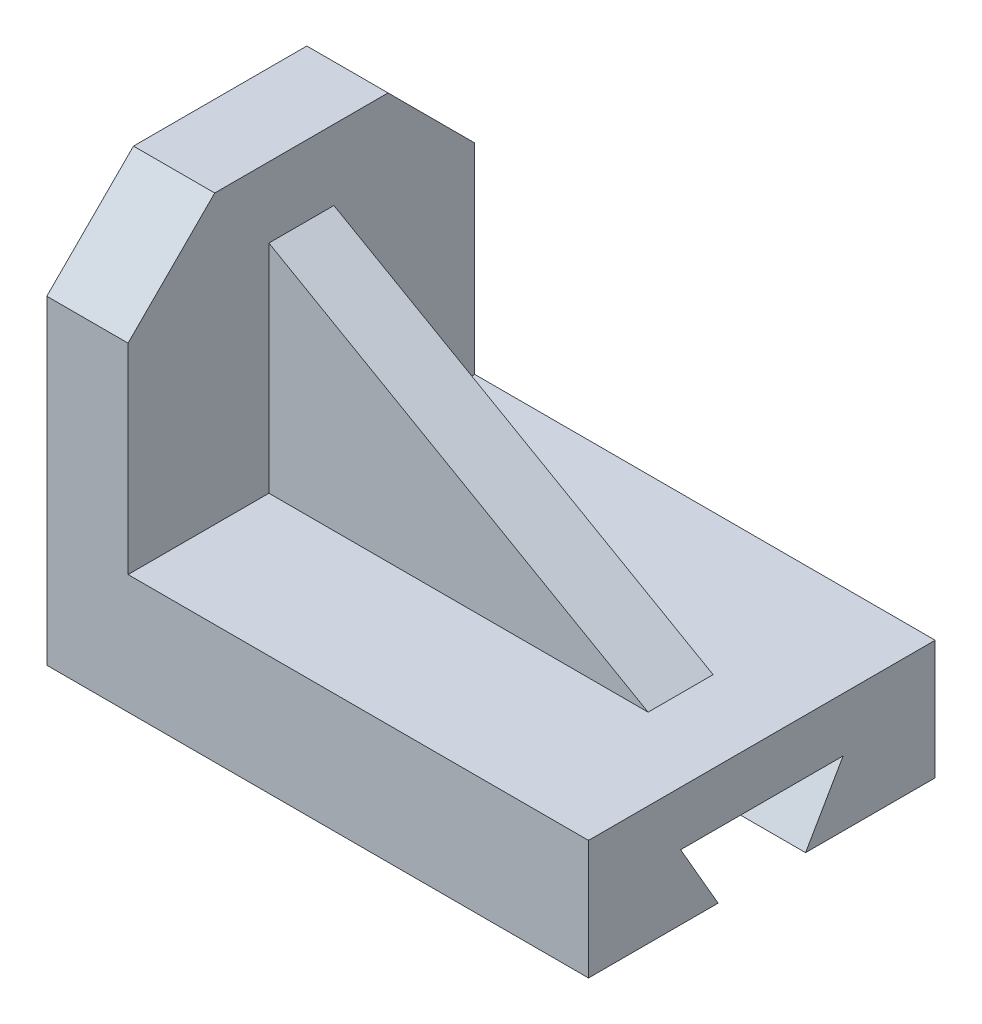
from build123d import *

# Parameters (mm, degrees)
SKETCH1_W           = 100
SKETCH1_H           = 22
BOSS_EXTRUDE1_DEPTH = 64
BOSS_EXTRUDE2_DEPTH = 15
SKETCH3_W           = 12
SKETCH3_H           = 40
BOSS_EXTRUDE3_DEPTH = 70
CUT_EXTRUDE1_DEPTH  = 70
CUT_EXTRUDE2_DEPTH  = 141.431477953


with BuildPart() as part:
    # Sketch1 → Boss-Extrude1 (new body)
    with BuildSketch(Plane.XY):
        with Locations((50, 11)):
            Rectangle(SKETCH1_W, SKETCH1_H)
    extrude(amount=BOSS_EXTRUDE1_DEPTH)

    # Sketch2 → Boss-Extrude2 (add)
    with BuildSketch(Plane.ZY):
        Polygon((64, 0), (0, 0), (0, 59), (16, 75), (48, 75), (64, 59), align=None)
    extrude(amount=-BOSS_EXTRUDE2_DEPTH)

    # Sketch3 → Boss-Extrude3 (add)
    with BuildSketch(Plane(origin=(15, 0, 0), x_dir=(0, 0, -1), z_dir=(1, 0, 0))):
        with Locations((-32, 42)):
            Rectangle(SKETCH3_W, SKETCH3_H)
    extrude(amount=BOSS_EXTRUDE3_DEPTH)

    # Sketch4 → Cut-Extrude1 (cut)
    with BuildSketch(Plane.XY.offset(38)):
        Polygon((15, 62), (85, 22), (85, 62), align=None)
    extrude(amount=-CUT_EXTRUDE1_DEPTH, mode=Mode.SUBTRACT)

    # Sketch6 → Cut-Extrude2 (cut, through all)
    with BuildSketch(Plane(origin=(100, 0, 0), x_dir=(0, 0, -1), z_dir=(1, 0, 0))):
        Polygon((-17, 12), (-47, 12), (-40.07179677, 0), (-23.92820323, 0), align=None)
    extrude(amount=-CUT_EXTRUDE2_DEPTH, mode=Mode.SUBTRACT)


solid = part.part
